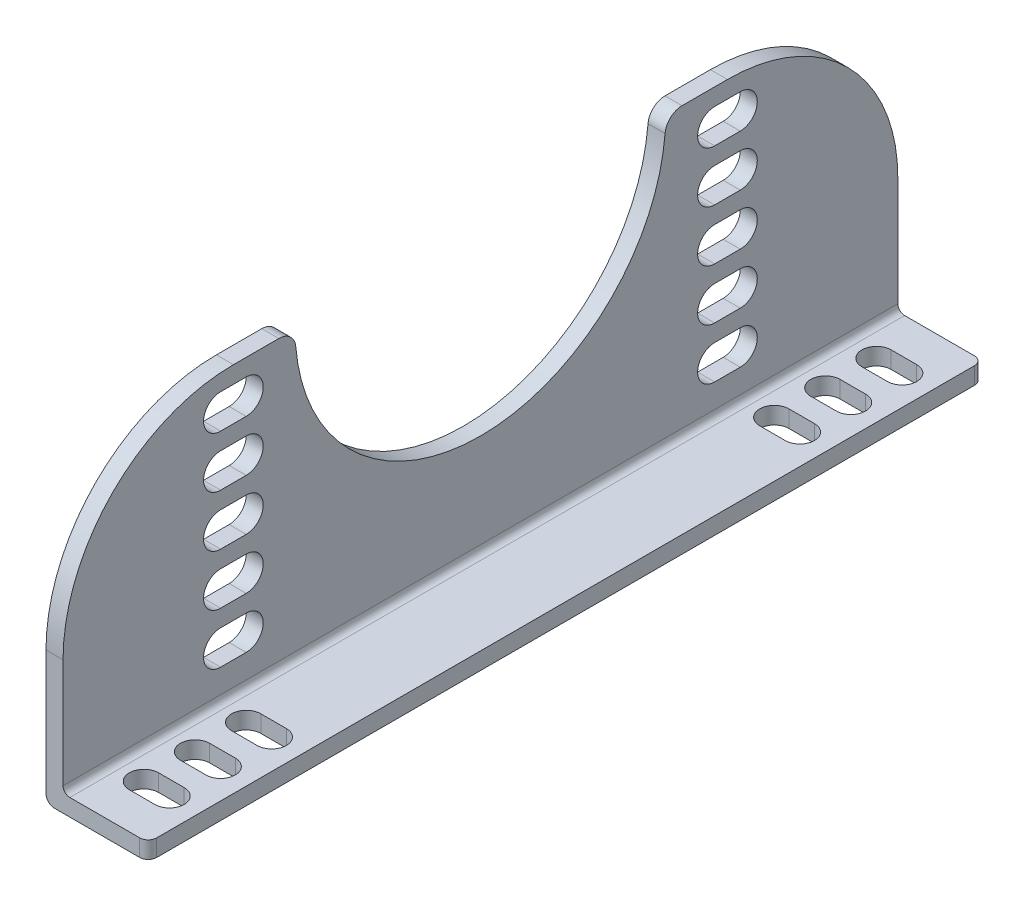
from build123d import *

# Parameters (mm, degrees)
SZKIC1_W                    = 10
SZKIC1_H                    = 178
DODANIE_WYCI_GNI_CIE1_DEPTH = 490
WYTNIJ_WYCI_GNI_CIE1_DEPTH  = 522.424970633
WYTNIJ_WYCI_GNI_CIE2_DEPTH  = 522.424970633
ZAOKR_GLENIE1_R             = 100
ZAOKR_GLENIE2_R             = 100
WYTNIJ_WYCI_GNI_CIE3_DEPTH  = 522.424970633
ZAOKR_GLENIE3_R             = 10
SZKIC6_W                    = 60
SZKIC6_H                    = 10
DODANIE_WYCI_GNI_CIE2_DEPTH = 490
ZAOKR_GLENIE4_R             = 5
ZAOKR_GLENIE5_R             = 4
ZAOKR_GLENIE6_R             = 5
WYTNIJ_WYCI_GNI_CIE4_DEPTH  = 10
WYTNIJ_WYCI_GNI_CIE5_DEPTH  = 10
WYTNIJ_WYCI_GNI_CIE6_DEPTH  = 10


with BuildPart() as part:
    # Szkic1 → Dodanie-wyciągnięcie1 (new body)
    with BuildSketch(Plane.XY):
        with Locations((-5, 89)):
            Rectangle(SZKIC1_W, SZKIC1_H)
    extrude(amount=DODANIE_WYCI_GNI_CIE1_DEPTH)

    # Szkic2 → Wytnij-wyciągnięcie1 (cut, through all)
    with BuildSketch(Plane(origin=(0, 0, 0), x_dir=(0, 0, -1), z_dir=(1, 0, 0))):
        with BuildLine():
            Line((-107.5, 168), (-92.5, 168))
            ThreePointArc((-92.5, 168), (-82.5, 158), (-92.5, 148))
            Line((-92.5, 148), (-107.5, 148))
            ThreePointArc((-107.5, 148), (-117.5, 158), (-107.5, 168))
        make_face()
        with BuildLine():
            Line((-107.5, 138), (-92.5, 138))
            ThreePointArc((-92.5, 138), (-82.5, 128), (-92.5, 118))
            Line((-92.5, 118), (-107.5, 118))
            ThreePointArc((-107.5, 118), (-117.5, 128), (-107.5, 138))
        make_face()
        with BuildLine():
            Line((-107.5, 108), (-92.5, 108))
            ThreePointArc((-92.5, 108), (-82.5, 98), (-92.5, 88))
            Line((-92.5, 88), (-107.5, 88))
            ThreePointArc((-107.5, 88), (-117.5, 98), (-107.5, 108))
        make_face()
        with BuildLine():
            Line((-107.5, 78), (-92.5, 78))
            ThreePointArc((-92.5, 78), (-82.5, 68), (-92.5, 58))
            Line((-92.5, 58), (-107.5, 58))
            ThreePointArc((-107.5, 58), (-117.5, 68), (-107.5, 78))
        make_face()
        with BuildLine():
            Line((-107.5, 48), (-92.5, 48))
            ThreePointArc((-92.5, 48), (-82.5, 38), (-92.5, 28))
            Line((-92.5, 28), (-107.5, 28))
            ThreePointArc((-107.5, 28), (-117.5, 38), (-107.5, 48))
        make_face()
    extrude(amount=-WYTNIJ_WYCI_GNI_CIE1_DEPTH, mode=Mode.SUBTRACT)

    # Szkic3 → Wytnij-wyciągnięcie2 (cut, through all)
    with BuildSketch(Plane(origin=(0, 0, 0), x_dir=(0, 0, -1), z_dir=(1, 0, 0))):
        with BuildLine():
            Line((-397.5, 168), (-382.5, 168))
            ThreePointArc((-382.5, 168), (-372.5, 158), (-382.5, 148))
            Line((-382.5, 148), (-397.5, 148))
            ThreePointArc((-397.5, 148), (-407.5, 158), (-397.5, 168))
        make_face()
        with BuildLine():
            Line((-397.5, 138), (-382.5, 138))
            ThreePointArc((-382.5, 138), (-372.5, 128), (-382.5, 118))
            Line((-382.5, 118), (-397.5, 118))
            ThreePointArc((-397.5, 118), (-407.5, 128), (-397.5, 138))
        make_face()
        with BuildLine():
            Line((-397.5, 108), (-382.5, 108))
            ThreePointArc((-382.5, 108), (-372.5, 98), (-382.5, 88))
            Line((-382.5, 88), (-397.5, 88))
            ThreePointArc((-397.5, 88), (-407.5, 98), (-397.5, 108))
        make_face()
        with BuildLine():
            Line((-397.5, 78), (-382.5, 78))
            ThreePointArc((-382.5, 78), (-372.5, 68), (-382.5, 58))
            Line((-382.5, 58), (-397.5, 58))
            ThreePointArc((-397.5, 58), (-407.5, 68), (-397.5, 78))
        make_face()
        with BuildLine():
            Line((-397.5, 48), (-382.5, 48))
            ThreePointArc((-382.5, 48), (-372.5, 38), (-382.5, 28))
            Line((-382.5, 28), (-397.5, 28))
            ThreePointArc((-397.5, 28), (-407.5, 38), (-397.5, 48))
        make_face()
    extrude(amount=-WYTNIJ_WYCI_GNI_CIE2_DEPTH, mode=Mode.SUBTRACT)

    # Zaokrąglenie1
    zaokr_glenie1_edges = [part.edges().sort_by_distance(p)[0] for p in [
        (-5, 178, 0),
    ]]
    fillet(zaokr_glenie1_edges, radius=ZAOKR_GLENIE1_R)

    # Zaokrąglenie2
    zaokr_glenie2_edges = [part.edges().sort_by_distance(p)[0] for p in [
        (-5, 178, 490),
    ]]
    fillet(zaokr_glenie2_edges, radius=ZAOKR_GLENIE2_R)

    # Szkic5 → Wytnij-wyciągnięcie3 (cut, through all)
    with BuildSketch(Plane.ZY.offset(10)):
        with BuildLine():
            Line((136.235236097, 178), (353.764763903, 178))
            ThreePointArc((353.764763903, 178), (245, 69.235236097), (136.235236097, 178))
        make_face()
    extrude(amount=-WYTNIJ_WYCI_GNI_CIE3_DEPTH, mode=Mode.SUBTRACT)

    # Zaokrąglenie3
    zaokr_glenie3_edges = [part.edges().sort_by_distance(p)[0] for p in [
        (-5, 178, 353.764763903),
        (-5, 178, 136.235236097),
    ]]
    fillet(zaokr_glenie3_edges, radius=ZAOKR_GLENIE3_R)

    # Szkic6 → Dodanie-wyciągnięcie2 (add, through all)
    with BuildSketch(Plane(origin=(0, 0, 0), x_dir=(-1, 0, 0), z_dir=(0, 0, -1))):
        with Locations((-20, 5)):
            Rectangle(SZKIC6_W, SZKIC6_H)
    extrude(amount=-DODANIE_WYCI_GNI_CIE2_DEPTH)

    # Zaokrąglenie4
    zaokr_glenie4_edges = [part.edges().sort_by_distance(p)[0] for p in [
        (-10, 0, 245),
    ]]
    fillet(zaokr_glenie4_edges, radius=ZAOKR_GLENIE4_R)

    # Zaokrąglenie5
    zaokr_glenie5_edges = [part.edges().sort_by_distance(p)[0] for p in [
        (0, 10, 245),
    ]]
    fillet(zaokr_glenie5_edges, radius=ZAOKR_GLENIE5_R)

    # Zaokrąglenie6
    zaokr_glenie6_edges = [part.edges().sort_by_distance(p)[0] for p in [
        (50, 5, 0),
        (50, 5, 490),
    ]]
    fillet(zaokr_glenie6_edges, radius=ZAOKR_GLENIE6_R)

    # Szkic7 → Wytnij-wyciągnięcie4 (cut)
    with BuildSketch(Plane(origin=(0, 10, 0), x_dir=(1, 0, 0), z_dir=(0, 1, 0))):
        with BuildLine():
            Line((32.5, -468.6), (17.5, -468.6))
            ThreePointArc((17.5, -468.6), (8.9, -460), (17.5, -451.4))
            Line((17.5, -451.4), (32.5, -451.4))
            ThreePointArc((32.5, -451.4), (41.1, -460), (32.5, -468.6))
        make_face()
    wytnij_wyci_gni_cie4 = extrude(amount=-WYTNIJ_WYCI_GNI_CIE4_DEPTH, mode=Mode.SUBTRACT)

    # Lustro2: Wytnij-wyciągnięcie4 across plane
    add(wytnij_wyci_gni_cie4.mirror(Plane(origin=(0, 0, 245), x_dir=(1, 0, 0), z_dir=(0, 0, -1))), mode=Mode.SUBTRACT)

    # Szkic8 → Wytnij-wyciągnięcie5 (cut)
    with BuildSketch(Plane(origin=(0, 10, 0), x_dir=(1, 0, 0), z_dir=(0, 1, 0))):
        with BuildLine():
            Line((17.5, -421.4), (32.5, -421.4))
            ThreePointArc((32.5, -421.4), (41.1, -430), (32.5, -438.6))
            Line((32.5, -438.6), (17.5, -438.6))
            ThreePointArc((17.5, -438.6), (8.9, -430), (17.5, -421.4))
        make_face()
    wytnij_wyci_gni_cie5 = extrude(amount=-WYTNIJ_WYCI_GNI_CIE5_DEPTH, mode=Mode.SUBTRACT)

    # Lustro3: Wytnij-wyciągnięcie5 across plane
    add(wytnij_wyci_gni_cie5.mirror(Plane(origin=(0, 0, 245), x_dir=(1, 0, 0), z_dir=(0, 0, -1))), mode=Mode.SUBTRACT)

    # Szkic9 → Wytnij-wyciągnięcie6 (cut)
    with BuildSketch(Plane(origin=(0, 10, 0), x_dir=(1, 0, 0), z_dir=(0, 1, 0))):
        with BuildLine():
            Line((17.5, -391.4), (32.5, -391.4))
            ThreePointArc((32.5, -391.4), (41.1, -400), (32.5, -408.6))
            Line((32.5, -408.6), (17.5, -408.6))
            ThreePointArc((17.5, -408.6), (8.9, -400), (17.5, -391.4))
        make_face()
    wytnij_wyci_gni_cie6 = extrude(amount=-WYTNIJ_WYCI_GNI_CIE6_DEPTH, mode=Mode.SUBTRACT)

    # Lustro4: Wytnij-wyciągnięcie6 across plane
    add(wytnij_wyci_gni_cie6.mirror(Plane(origin=(0, 0, 245), x_dir=(1, 0, 0), z_dir=(0, 0, -1))), mode=Mode.SUBTRACT)


solid = part.part
